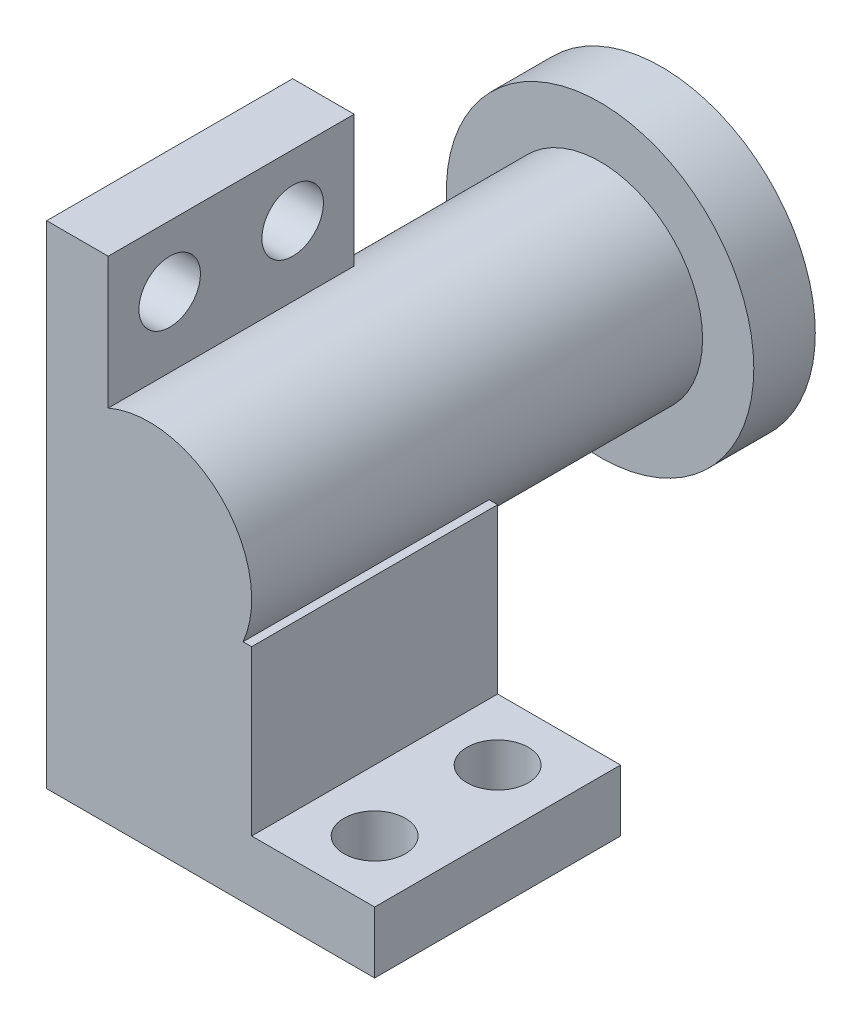
from build123d import *

# Parameters (mm, degrees)
SKETCH_1_W          = 5
SKETCH_1_H          = 8
EXTRUDE_1_DEPTH     = 12
SKETCH_2_R          = 5
EXTRUDE_2_DEPTH     = 10
SKETCH_3_R          = 7.5
EXTRUDE_3_DEPTH     = 3
SKETCH_4_R          = 1.5
CUT_EXTRUDE_1_DEPTH = 3
SKETCH_5_R          = 1.5
CUT_EXTRUDE_2_DEPTH = 11
SKETCH_6_W          = 6
SKETCH_6_H          = 12
CUT_EXTRUDE_3_DEPTH = 8


with BuildPart() as part:
    # 草图1 → 凸台-拉伸1 (new body)
    with BuildSketch(Plane.XY):
        with BuildLine():
            Line((11, -2), (4.582575695, -2))
            ThreePointArc((4.582575695, -2), (3.535533906, 3.535533906), (-2, 4.582575695))
            Line((-2, 4.582575695), (-2, 11))
            Line((-2, 11), (-5, 11))
            Line((-5, 11), (-5, 0))
            Line((-5, 0), (-5, -5))
            Line((-5, -5), (0, -5))
            Line((0, -5), (11, -5))
            Line((11, -5), (11, -2))
        make_face()
        Polygon((-5, -13), (-5, -5), (0, -5), (11, -5), (11, -13), align=None)
        with Locations((-2.5, -9)):
            Rectangle(SKETCH_1_W, SKETCH_1_H)
    extrude(amount=EXTRUDE_1_DEPTH)

    # 草图2 → 凸台-拉伸2 (add)
    with BuildSketch(Plane.XY.offset(12)):
        with Locations(Location((0, 0, 0), (0, 0, 180))):
            Circle(SKETCH_2_R)
    extrude(amount=EXTRUDE_2_DEPTH)

    # 草图3 → 凸台-拉伸3 (add)
    with BuildSketch(Plane.XY.offset(22)):
        Circle(SKETCH_3_R)
    extrude(amount=EXTRUDE_3_DEPTH)

    # 草图4 → 切除-拉伸1 (cut)
    with BuildSketch(Plane(origin=(-2, 0, 0), x_dir=(0, 0, -1), z_dir=(1, 0, 0))):
        with Locations(Location((-9, 7.998538294, 0), (0, 0, 90))):
            Circle(SKETCH_4_R)
        with Locations(Location((-3, 7.998538294, 0), (0, 0, 90))):
            Circle(SKETCH_4_R)
    extrude(amount=-CUT_EXTRUDE_1_DEPTH, mode=Mode.SUBTRACT)

    # 草图5 → 切除-拉伸2 (cut)
    with BuildSketch(Plane(origin=(0, -2, 0), x_dir=(1, 0, 0), z_dir=(0, 1, 0))):
        with Locations(Location((8, -9, 0), (0, 0, 270))):
            Circle(SKETCH_5_R)
        with Locations(Location((8, -3, 0), (0, 0, 270))):
            Circle(SKETCH_5_R)
    extrude(amount=-CUT_EXTRUDE_2_DEPTH, mode=Mode.SUBTRACT)

    # 草图6 → 切除-拉伸3 (cut)
    with BuildSketch(Plane(origin=(0, -2, 0), x_dir=(1, 0, 0), z_dir=(0, 1, 0))):
        with Locations((8, -6)):
            Rectangle(SKETCH_6_W, SKETCH_6_H)
    extrude(amount=-CUT_EXTRUDE_3_DEPTH, mode=Mode.SUBTRACT)


with BuildPart() as body_2:
    # 镜向1: mirrored copy
    add(part.part.mirror(Plane.XY.offset(25)))


solid = body_2.part
